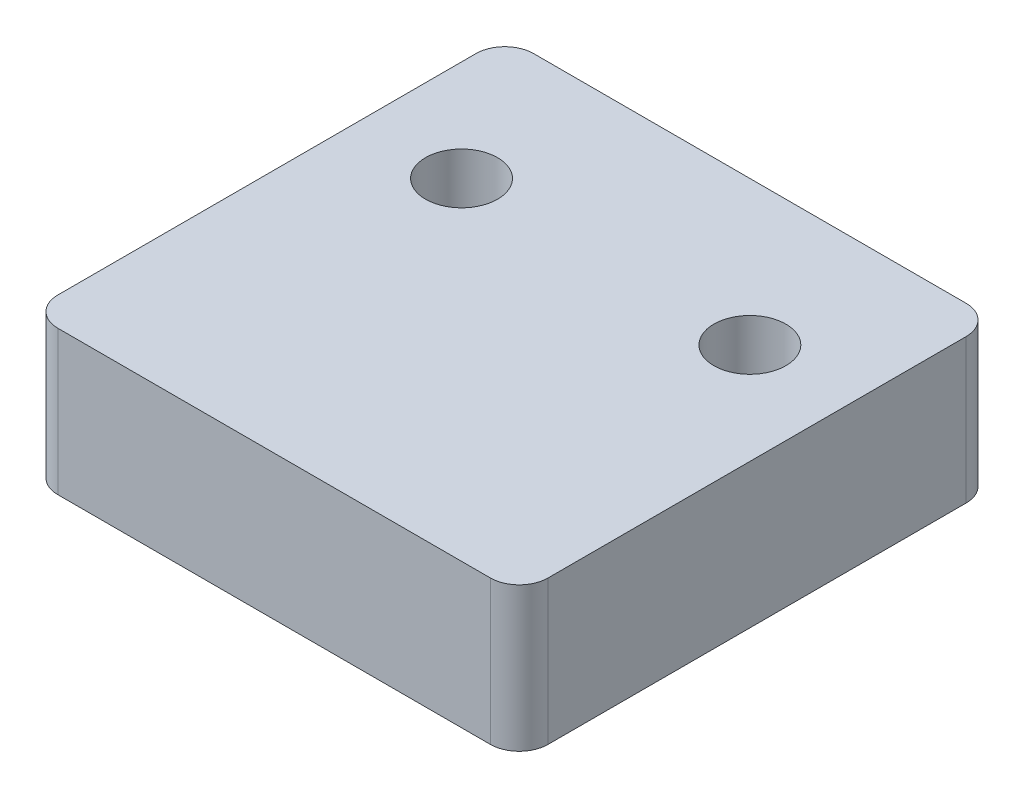
from build123d import *

# Parameters (mm, degrees)
SKETCH2_W           = 34
SKETCH2_H           = 33
BOSS_EXTRUDE1_DEPTH = 10
FILLET1_R           = 2
FILLET2_R           = 2
FILLET3_R           = 2
FILLET4_R           = 2
SKETCH3_R           = 2.5
CUT_EXTRUDE1_DEPTH  = 10


with BuildPart() as part:
    # Sketch2 → Boss-Extrude1 (new body)
    with BuildSketch(Plane(origin=(0, 0, 0), x_dir=(1, 0, 0), z_dir=(0, 1, 0))):
        with Locations((17, 16.5)):
            Rectangle(SKETCH2_W, SKETCH2_H)
    extrude(amount=BOSS_EXTRUDE1_DEPTH)

    # Fillet1
    fillet1_edges = [part.edges().sort_by_distance(p)[0] for p in [
        (34, 5, 0),
    ]]
    fillet(fillet1_edges, radius=FILLET1_R)

    # Fillet2
    fillet2_edges = [part.edges().sort_by_distance(p)[0] for p in [
        (34, 5, -33),
    ]]
    fillet(fillet2_edges, radius=FILLET2_R)

    # Fillet3
    fillet3_edges = [part.edges().sort_by_distance(p)[0] for p in [
        (0, 5, -33),
    ]]
    fillet(fillet3_edges, radius=FILLET3_R)

    # Fillet4
    fillet4_edges = [part.edges().sort_by_distance(p)[0] for p in [
        (0, 5, 0),
    ]]
    fillet(fillet4_edges, radius=FILLET4_R)

    # Sketch3 → Cut-Extrude1 (cut)
    with BuildSketch(Plane(origin=(0, 10, 0), x_dir=(1, 0, 0), z_dir=(0, 1, 0))):
        with Locations(Location((7, 23, 0), (0, 0, 270))):
            Circle(SKETCH3_R)
        with Locations(Location((27, 23, 0), (0, 0, 270))):
            Circle(SKETCH3_R)
    extrude(amount=-CUT_EXTRUDE1_DEPTH, mode=Mode.SUBTRACT)


solid = part.part
